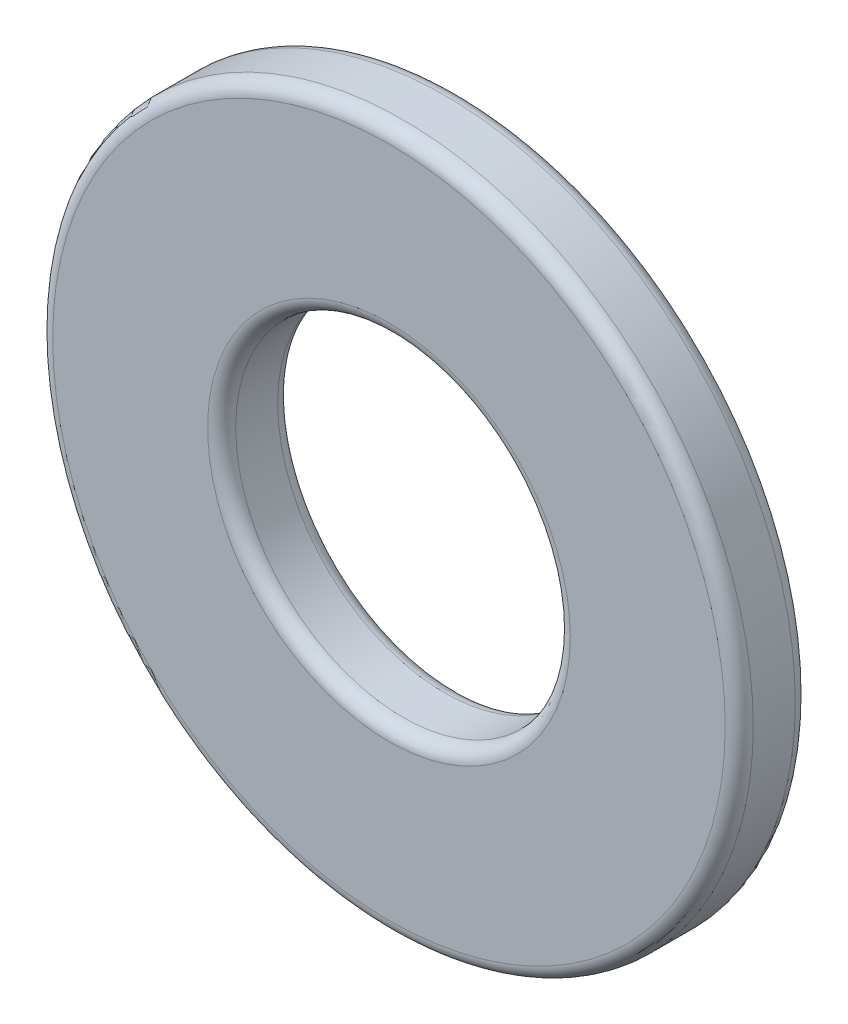
from build123d import *

# Parameters (mm, degrees)
BOSS_EXTRUDE1_DEPTH      = 0.45
BOSS_EXTRUDE1_DEPTH_BACK = 0.45
SKETCH3_R                = 4.5
SKETCH3_R_2              = 2.15
FILLET1_R                = 0.18


with BuildPart() as part:
    # Sketch3 → Boss-Extrude1 (new, two sides: drawn at the far end of the back side and taken through both)
    with BuildSketch(Plane.XY.offset(-BOSS_EXTRUDE1_DEPTH_BACK)):
        Circle(SKETCH3_R)
        Circle(SKETCH3_R_2, mode=Mode.SUBTRACT)
    extrude(amount=BOSS_EXTRUDE1_DEPTH + BOSS_EXTRUDE1_DEPTH_BACK)

    # Fillet1
    fillet1_edges = [part.edges().sort_by_distance(p)[0] for p in [
        (-4.5, 0, -0.45),
        (-2.15, 0, -0.45),
        (-4.5, 0, 0.45),
        (-2.15, 0, 0.45),
    ]]
    fillet(fillet1_edges, radius=FILLET1_R)


solid = part.part
